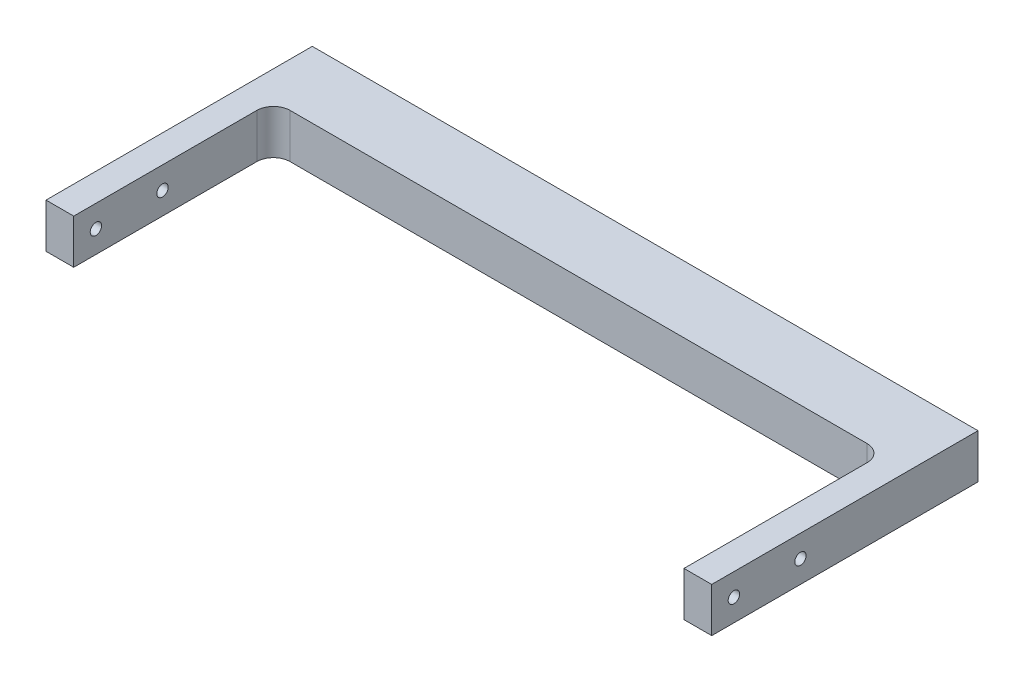
from build123d import *

# Parameters (mm, degrees)
EXTRUDE1_DEPTH               = 25.4
FILLET1_R                    = 9.525
F_5_16_18_TAPPED_HOLE1_D     = 6.5278
F_5_16_18_TAPPED_HOLE1_DEPTH = 15.875
F_5_16_18_TAPPED_HOLE2_D     = 6.5278


with BuildPart() as part:
    # Sketch1 → Extrude1 (new body)
    with BuildSketch(Plane(origin=(0, 0, 0), x_dir=(1, 0, 0), z_dir=(0, 1, 0))):
        Polygon((174.625, -152.4), (190.5, -152.4), (190.5, 0), (-190.5, 0), (-190.5, -152.4), (-174.625, -152.4), (-174.625, -38.1), (174.625, -38.1), align=None)
    extrude(amount=EXTRUDE1_DEPTH)

    # Fillet1
    fillet1_edges = [part.edges().sort_by_distance(p)[0] for p in [
        (174.625, 12.7, 38.1),
        (-174.625, 12.7, 38.1),
    ]]
    fillet(fillet1_edges, radius=FILLET1_R)

    # 5/16-18 Tapped Hole1
    with Locations(Plane(origin=(190.5, 0, 0), x_dir=(0, 0, -1), z_dir=(1, 0, 0))):
        with Locations((-139.7, 12.7), (-101.6, 12.7)):
            Hole(F_5_16_18_TAPPED_HOLE1_D / 2, depth=F_5_16_18_TAPPED_HOLE1_DEPTH)

    # 5/16-18 Tapped Hole2 (through all)
    with Locations(Plane.ZY.offset(190.5)):
        with Locations((101.6, 12.7), (139.7, 12.7)):
            Hole(F_5_16_18_TAPPED_HOLE2_D / 2)


solid = part.part
